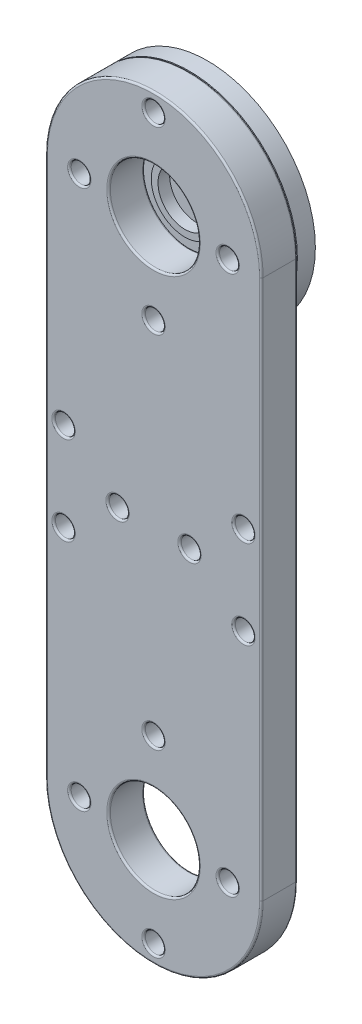
from build123d import *

# Parameters (mm, degrees)
SKETCH_2_R            = 0.75
CUT_EXTRUDE_1_DEPTH   = 18.557049866
SKETCH_1_2_R          = 5
SKETCH_1_2_R_2        = 1.1
EXTRUDE_1_DEPTH       = 4
SKETCH_2_2_R          = 1.1
CUT_EXTRUDE_1_2_DEPTH = 74.131730459
FILLET_1_R            = 0.2


with BuildPart() as part:
    # Sketch 1 → Повернуть1 (revolve)
    with BuildSketch(Plane(origin=(0, 0, 0), x_dir=(0, 0, -1), z_dir=(1, 0, 0)), mode=Mode.PRIVATE) as revolve_1_sk:
        Polygon((0, 3.75), (0, 12), (2, 12), (2, 4.5), (4.5, 4.5), (4.5, 3), (1.5, 3), (1.5, 1.4), (0.8, 1.4), (0.8, 3), (-0.5, 3), (-0.5, 3.75), align=None)
    revolve(revolve_1_sk.sketch.rotate(Axis((0, 0, 50), (0, 0, -1)), 90), axis=Axis((0, 0, 50), (0, 0, -1)))

    # Sketch 2 → Cut-Extrude 1 (cut, through all)
    with BuildSketch(Plane.XY):
        with Locations((8.25, 0)):
            Circle(SKETCH_2_R)
        with Locations((7.752464121, -2.821666182)):
            Circle(SKETCH_2_R)
        with Locations((7.752464121, 2.821666182)):
            Circle(SKETCH_2_R)
        with Locations((-8.25, 0)):
            Circle(SKETCH_2_R)
        with Locations((-7.752464121, -2.821666182)):
            Circle(SKETCH_2_R)
        with Locations((-7.752464121, 2.821666182)):
            Circle(SKETCH_2_R)
        with Locations((0, 7)):
            Circle(SKETCH_2_R)
        with Locations((0, 10)):
            Circle(SKETCH_2_R)
        with Locations((2.394141003, 6.577848346)):
            Circle(SKETCH_2_R)
        with Locations((3.420201433, 9.396926208)):
            Circle(SKETCH_2_R)
        with Locations((-2.394141003, 6.577848346)):
            Circle(SKETCH_2_R)
        with Locations((-3.420201433, 9.396926208)):
            Circle(SKETCH_2_R)
        with Locations((0, -7)):
            Circle(SKETCH_2_R)
        with Locations((0, -10)):
            Circle(SKETCH_2_R)
        with Locations((3.420201433, -9.396926208)):
            Circle(SKETCH_2_R)
        with Locations((2.394141003, -6.577848346)):
            Circle(SKETCH_2_R)
        with Locations((-2.394141003, -6.577848346)):
            Circle(SKETCH_2_R)
        with Locations((-3.420201433, -9.396926208)):
            Circle(SKETCH_2_R)
    extrude(amount=-CUT_EXTRUDE_1_DEPTH, mode=Mode.SUBTRACT)


with BuildPart() as body_2:
    # Sketch 1 2 → 보스-돌출1 (new body)
    with BuildSketch(Plane.XY):
        with BuildLine():
            Line((-12, 0), (-12, -60))
            ThreePointArc((-12, -60), (0, -72), (12, -60))
            Line((12, -60), (12, 0))
            ThreePointArc((12, 0), (0, 12), (-12, 0))
        make_face()
        Circle(SKETCH_1_2_R, mode=Mode.SUBTRACT)
        with Locations((0, -60)):
            Circle(SKETCH_1_2_R, mode=Mode.SUBTRACT)
        with Locations((-8.25, 0)):
            Circle(SKETCH_1_2_R_2, mode=Mode.SUBTRACT)
        with Locations((0, 10)):
            Circle(SKETCH_1_2_R_2, mode=Mode.SUBTRACT)
        with Locations((8.25, 0)):
            Circle(SKETCH_1_2_R_2, mode=Mode.SUBTRACT)
        with Locations((0, -10)):
            Circle(SKETCH_1_2_R_2, mode=Mode.SUBTRACT)
        with Locations((0, -50)):
            Circle(SKETCH_1_2_R_2, mode=Mode.SUBTRACT)
        with Locations((8.25, -60)):
            Circle(SKETCH_1_2_R_2, mode=Mode.SUBTRACT)
        with Locations((-8.25, -60)):
            Circle(SKETCH_1_2_R_2, mode=Mode.SUBTRACT)
        with Locations((0, -70)):
            Circle(SKETCH_1_2_R_2, mode=Mode.SUBTRACT)
    extrude(amount=EXTRUDE_1_DEPTH)

    # Sketch 2 2 → Cut-Extrude 1 2 (cut, through all)
    with BuildSketch(Plane(origin=(0, 0, 0), x_dir=(-1, 0, 0), z_dir=(0, 0, -1))):
        with Locations((-10, -25.079872408)):
            Circle(SKETCH_2_2_R)
        with Locations((-4, -30)):
            Circle(SKETCH_2_2_R)
        with Locations((4, -30)):
            Circle(SKETCH_2_2_R)
        with Locations((10, -25.079872408)):
            Circle(SKETCH_2_2_R)
        with Locations((10, -34.920127592)):
            Circle(SKETCH_2_2_R)
        with Locations((-10, -34.920127592)):
            Circle(SKETCH_2_2_R)
    extrude(amount=-CUT_EXTRUDE_1_2_DEPTH, mode=Mode.SUBTRACT)

    # 필렛1
    fillet_1_edges = [body_2.edges().sort_by_distance(p)[0] for p in [
        (-9.35, -60, 4),
        (-5, 0, 0),
        (-9.35, 0, 0),
        (-1.1, 10, 0),
        (7.15, 0, 0),
        (-1.1, -10, 0),
        (-1.1, -50, 4),
        (-1.1, -70, 0),
        (7.15, -60, 0),
        (-5, -60, 0),
        (-12, -30, 0),
        (0, 12, 0),
        (12, -30, 0),
        (0, -72, 0),
        (-1.1, -50, 0),
        (-9.35, -60, 0),
        (0, -72, 4),
        (12, -30, 4),
        (0, 12, 4),
        (-12, -30, 4),
        (-5, -60, 4),
        (7.15, -60, 4),
        (11.1, -34.920127592, 4),
        (11.1, -34.920127592, 0),
        (-1.1, -70, 4),
        (5.1, -30, 4),
        (5.1, -30, 0),
        (-2.9, -30, 4),
        (-2.9, -30, 0),
        (-8.9, -25.079872408, 4),
        (-8.9, -25.079872408, 0),
        (-1.1, -10, 4),
        (-8.9, -34.920127592, 4),
        (-8.9, -34.920127592, 0),
        (11.1, -25.079872408, 4),
        (11.1, -25.079872408, 0),
        (7.15, 0, 4),
        (-1.1, 10, 4),
        (-9.35, 0, 4),
        (-5, 0, 4),
    ]]
    fillet(fillet_1_edges, radius=FILLET_1_R)


solid = Compound([part.part, body_2.part])
